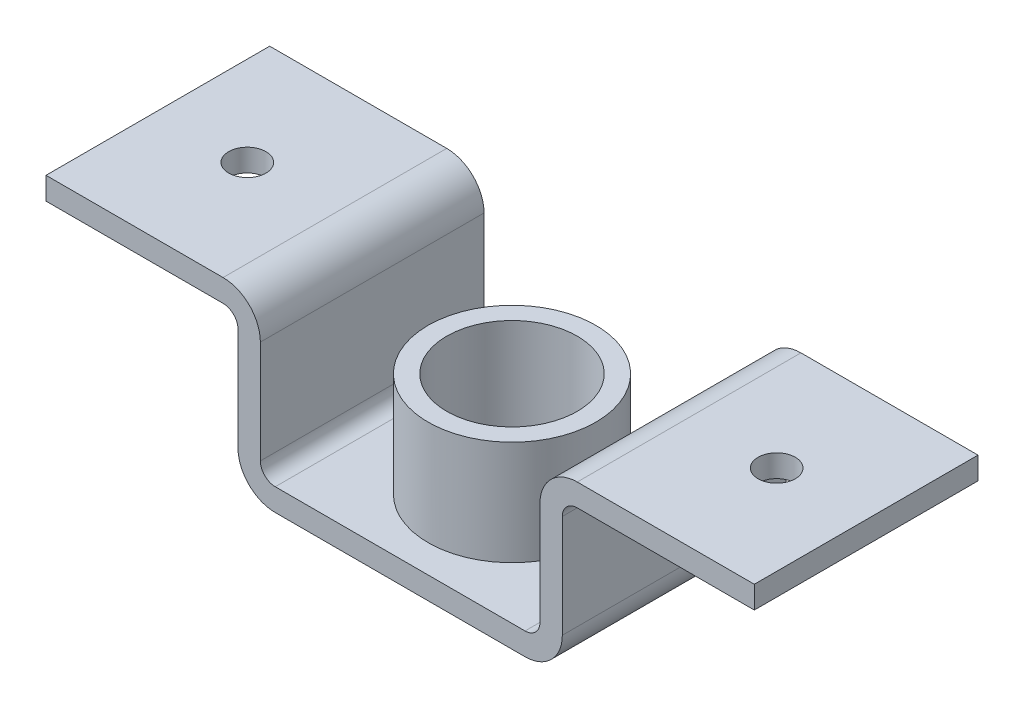
from build123d import *

# Parameters (mm, degrees)
BOSS_EXTRUDE1_DEPTH = 150
SKETCH2_R           = 112.5
SKETCH2_R_2         = 87.5
BOSS_EXTRUDE2_DEPTH = 140
SKETCH3_R           = 37.5
CUT_EXTRUDE1_DEPTH  = 139
SKETCH4_R           = 25
CUT_EXTRUDE2_DEPTH  = 139
FILLET1_R           = 50
FILLET2_R           = 20


with BuildPart() as part:
    # Sketch1 → Boss-Extrude1 (new, symmetric)
    with BuildSketch(Plane.XY):
        with BuildLine():
            Line((-475, 33.603864734), (-217.5, 33.603864734))
            Line((-217.5, 33.603864734), (-217.5, -124.396135266))
            ThreePointArc((-217.5, -124.396135266), (-202.855339059, -159.751474325), (-167.5, -174.396135266))
            Line((-167.5, -174.396135266), (167.5, -174.396135266))
            ThreePointArc((167.5, -174.396135266), (202.855339059, -159.751474325), (217.5, -124.396135266))
            Line((217.5, -124.396135266), (217.5, 33.603864734))
            Line((217.5, 33.603864734), (475, 33.603864734))
            Line((475, 33.603864734), (475, 63.603864734))
            Line((475, 63.603864734), (187.5, 63.603864734))
            Line((187.5, 63.603864734), (187.5, -124.396135266))
            ThreePointArc((187.5, -124.396135266), (181.642135624, -138.538270889), (167.5, -144.396135266))
            Line((167.5, -144.396135266), (-167.5, -144.396135266))
            ThreePointArc((-167.5, -144.396135266), (-181.642135624, -138.538270889), (-187.5, -124.396135266))
            Line((-187.5, -124.396135266), (-187.5, 63.603864734))
            Line((-187.5, 63.603864734), (-475, 63.603864734))
            Line((-475, 63.603864734), (-475, 33.603864734))
        make_face()
    extrude(amount=BOSS_EXTRUDE1_DEPTH, both=True)

    # Sketch2 → Boss-Extrude2 (add)
    with BuildSketch(Plane(origin=(0, -144.396135266, 0), x_dir=(1, 0, 0), z_dir=(0, 1, 0))):
        Circle(SKETCH2_R)
        with Locations(Location((0, 0, 0), (0, 0, 180))):
            Circle(SKETCH2_R_2, mode=Mode.SUBTRACT)
    extrude(amount=BOSS_EXTRUDE2_DEPTH)

    # Sketch3 → Cut-Extrude1 (cut)
    with BuildSketch(Plane(origin=(0, -144.396135266, 0), x_dir=(1, 0, 0), z_dir=(0, 1, 0))):
        with Locations(Location((0, 0, 0), (0, 0, 180))):
            Circle(SKETCH3_R)
    extrude(amount=-CUT_EXTRUDE1_DEPTH, mode=Mode.SUBTRACT)

    # Sketch4 → Cut-Extrude2 (cut)
    with BuildSketch(Plane(origin=(0, 63.603864734, 0), x_dir=(1, 0, 0), z_dir=(0, 1, 0))):
        with Locations(Location((-355, 0, 0), (0, 0, 180))):
            Circle(SKETCH4_R)
        with Locations(Location((355, 0, 0), (0, 0, 180))):
            Circle(SKETCH4_R)
    extrude(amount=-CUT_EXTRUDE2_DEPTH, mode=Mode.SUBTRACT)

    # Fillet1
    fillet1_edges = [part.edges().sort_by_distance(p)[0] for p in [
        (-187.5, 63.603864734, 0),
        (187.5, 63.603864734, 0),
    ]]
    fillet(fillet1_edges, radius=FILLET1_R)

    # Fillet2
    fillet2_edges = [part.edges().sort_by_distance(p)[0] for p in [
        (217.5, 33.603864734, 0),
        (-217.5, 33.603864734, 0),
    ]]
    fillet(fillet2_edges, radius=FILLET2_R)


solid = part.part
